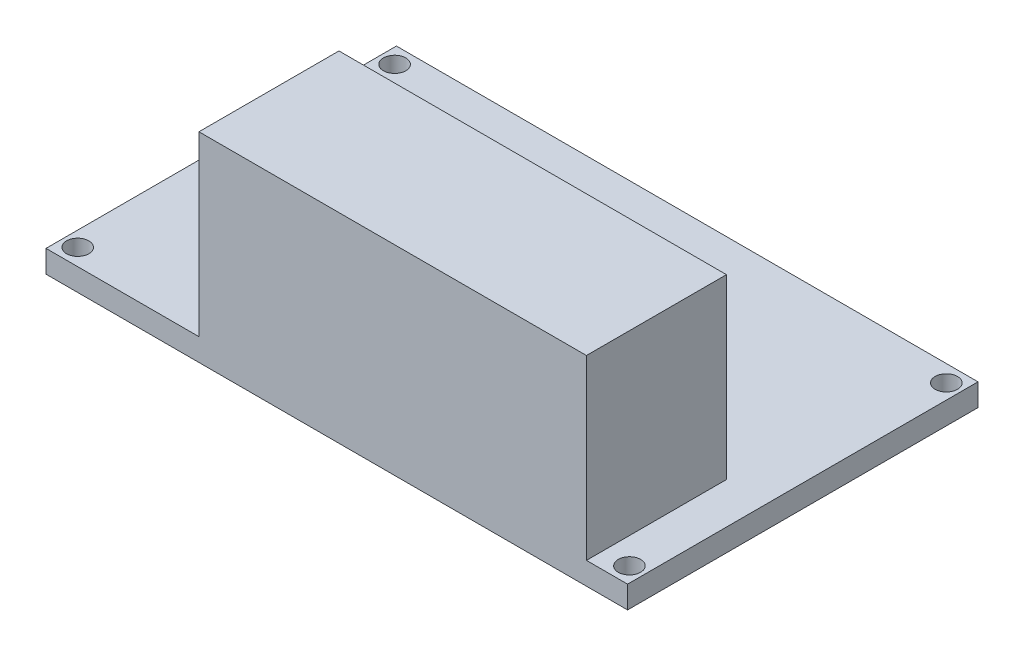
from build123d import *

# Parameters (mm, degrees)
SKETCH2_W               = 99.06
SKETCH2_H               = 59.69
BOSS_EXTRUDE1_DEPTH     = 3.81
CUT_EXTRUDE1_DEPTH      = 58.952230544
CUT_EXTRUDE1_DEPTH_BACK = 58.952230544
SKETCH3_R               = 1.905
SKETCH4_W               = 66.005411874
SKETCH4_H               = 23.84908854
BOSS_EXTRUDE2_DEPTH     = 30.226


with BuildPart() as part:
    # Sketch2 → Boss-Extrude1 (new body)
    with BuildSketch(Plane(origin=(0, 0, 0), x_dir=(1, 0, 0), z_dir=(0, 1, 0))):
        Rectangle(SKETCH2_W, SKETCH2_H)
    extrude(amount=BOSS_EXTRUDE1_DEPTH)

    # Sketch3 → Cut-Extrude1 (cut, two sides: drawn at the far end of the back side and taken through both)
    with BuildSketch(Plane(origin=(0, 3.81, 0), x_dir=(1, 0, 0), z_dir=(0, 1, 0)).offset(-CUT_EXTRUDE1_DEPTH_BACK)):
        with Locations(Location((-46.99, 26.9875, 0), (0, 0, 270))):
            Circle(SKETCH3_R)
        with Locations(Location((46.99, 26.9875, 0), (0, 0, 270))):
            Circle(SKETCH3_R)
        with Locations(Location((46.99, -26.9875, 0), (0, 0, 270))):
            Circle(SKETCH3_R)
        with Locations(Location((-46.99, -26.9875, 0), (0, 0, 270))):
            Circle(SKETCH3_R)
    extrude(amount=CUT_EXTRUDE1_DEPTH + CUT_EXTRUDE1_DEPTH_BACK, mode=Mode.SUBTRACT)

    # Sketch4 → Boss-Extrude2 (add)
    with BuildSketch(Plane(origin=(0, 3.81, 0), x_dir=(1, 0, 0), z_dir=(0, 1, 0))):
        with Locations((9.522918202, -17.92045573)):
            Rectangle(SKETCH4_W, SKETCH4_H)
    extrude(amount=BOSS_EXTRUDE2_DEPTH)


solid = part.part
